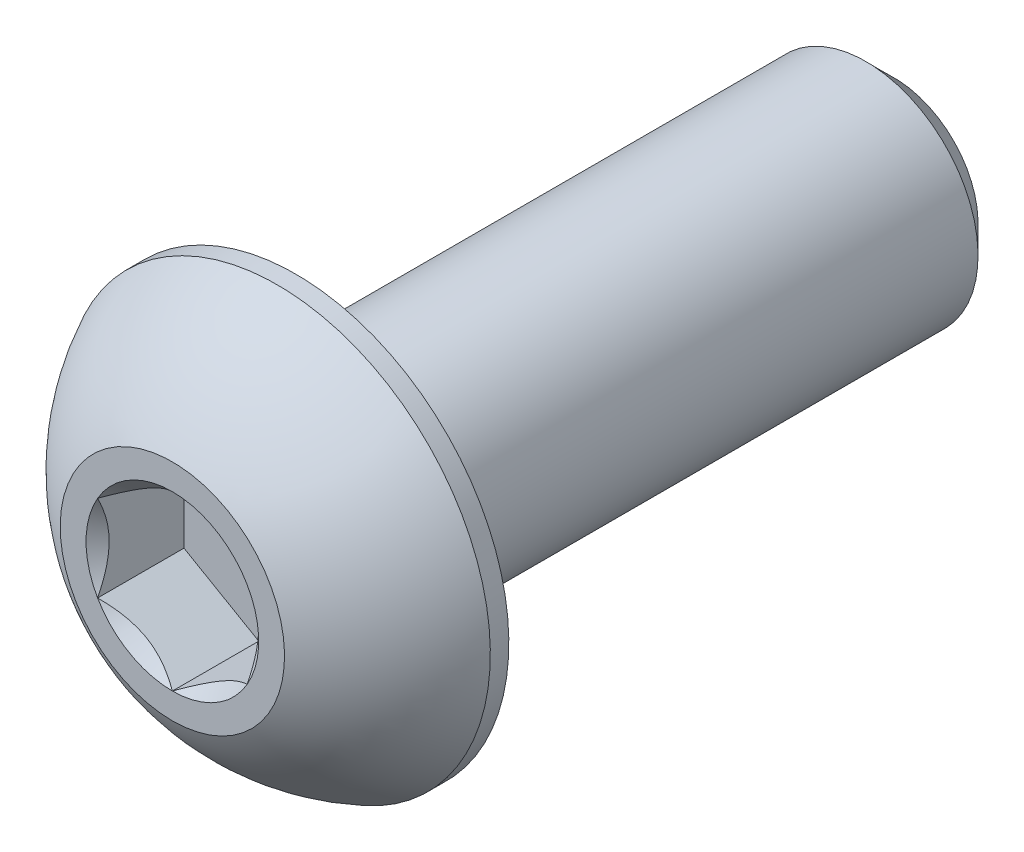
from build123d import *

# Parameters (mm, degrees)
CUT_EXTRUDE2_DEPTH = 1.155


with BuildPart() as part:
    # Sketch10 → Revolve3 (revolve)
    with BuildSketch(Plane(origin=(0, 0, 0), x_dir=(0, 0, -1), z_dir=(1, 0, 0))):
        Polygon((3.625, 1.5), (4, 1.125), (4, 0), (-4, 0), (-4, 1.5), align=None)
    revolve(axis=Axis((0, 0, 5.65), (0, 0, -1)))

    # Sketch7 → Revolve2 (revolve)
    with BuildSketch(Plane(origin=(0, 0, 0), x_dir=(0, 0, -1), z_dir=(1, 0, 0))):
        with BuildLine():
            Line((-4.2475, 2.85), (-4, 2.85))
            Line((-4, 2.85), (-4, 0))
            Line((-4, 0), (-5.65, 0))
            Line((-5.65, 0), (-5.65, 1.5))
            ThreePointArc((-5.65, 1.5), (-5.05487489, 2.285251969), (-4.2475, 2.85))
        make_face()
    revolve(axis=Axis((0, 0, 5.65), (0, 0, -1)))

    # Sketch5 → Cut-Extrude2 (cut)
    with BuildSketch(Plane.XY.offset(5.65)):
        Polygon((1, -0.577350269), (1, 0.577350269), (0, 1.154700538), (-1, 0.577350269), (-1, -0.577350269), (0, -1.154700538), align=None)
    extrude(amount=-CUT_EXTRUDE2_DEPTH, mode=Mode.SUBTRACT)

    # Cut-Extrude3 cone 1 section (through the dimple's axis) → Cut-Extrude3 (revolve, cut)
    with BuildSketch(Plane(origin=(0, 0, 5.65), x_dir=(0, -1, 0), z_dir=(1, 0, 0))):
        Polygon((0, 0), (1.154700538, 0), (0, 1.154700538), align=None)
    revolve(axis=Axis((0, 0, 5.65), (0, 0, -1)), mode=Mode.SUBTRACT)


solid = part.part
